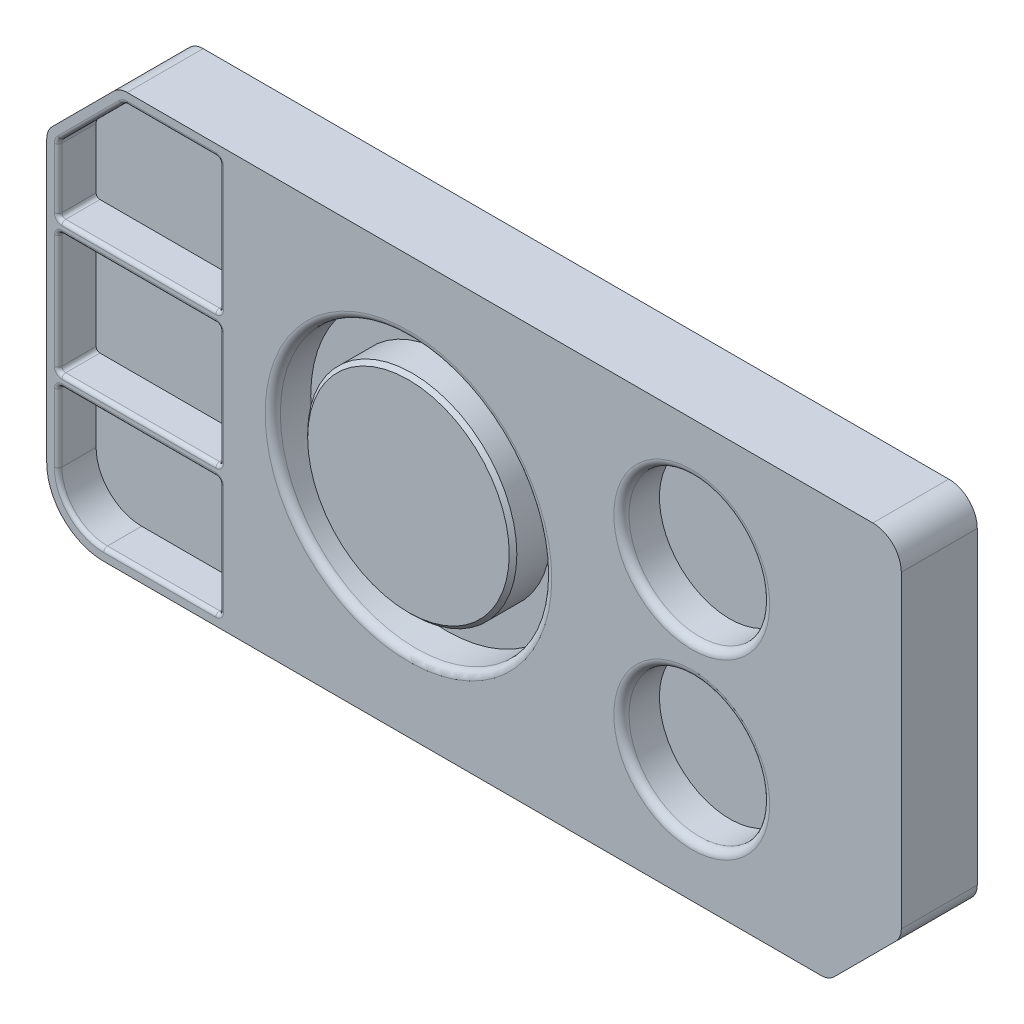
from build123d import *

# Parameters (mm, degrees)
SKETCH1_W           = 225
SKETCH1_H           = 110
BOSS_EXTRUDE2_DEPTH = 10
CHAMFER1_SIZE       = 19.1
FILLET1_R           = 15
FILLET2_R           = 7.5
FILLET3_R           = 5
BOSS_EXTRUDE4_START = 10
SKETCH4_R           = 18.521811602
SKETCH4_W           = 42.513723821
SKETCH4_H           = 32
SKETCH4_R_2         = 35.732188173
BOSS_EXTRUDE4_DEPTH = 10
FILLET4_R           = 2
SKETCH4_5_R         = 27.537925192
BOSS_EXTRUDE5_DEPTH = 10
CHAMFER2_SIZE       = 1
FILLET5_R           = 1
FILLET6_R           = 1
FILLET7_R           = 1


with BuildPart() as part:
    # Sketch1 → Boss-Extrude2 (new body)
    with BuildSketch(Plane.XY):
        Rectangle(SKETCH1_W, SKETCH1_H)
    extrude(amount=BOSS_EXTRUDE2_DEPTH)

    # Chamfer1
    chamfer1_edges = [part.edges().sort_by_distance(p)[0] for p in [
        (112.5, -55, 5),
        (-112.5, 55, 5),
    ]]
    chamfer(chamfer1_edges, length=CHAMFER1_SIZE)

    # Fillet1
    fillet1_edges = [part.edges().sort_by_distance(p)[0] for p in [
        (-112.5, -55, 5),
    ]]
    fillet(fillet1_edges, radius=FILLET1_R)

    # Fillet2
    fillet2_edges = [part.edges().sort_by_distance(p)[0] for p in [
        (112.5, 55, 5),
    ]]
    fillet(fillet2_edges, radius=FILLET2_R)

    # Fillet3
    fillet3_edges = [part.edges().sort_by_distance(p)[0] for p in [
        (112.5, -35.9, 5),
        (93.4, -55, 5),
        (-112.5, 35.9, 5),
        (-93.4, 55, 5),
    ]]
    fillet(fillet3_edges, radius=FILLET3_R)

    # Sketch4 → Boss-Extrude4 (add)
    with BuildSketch(Plane.XY.offset(10).offset(BOSS_EXTRUDE4_START)):
        with BuildLine():
            ThreePointArc((112.5, 47.5), (110.303300859, 52.803300859), (105, 55))
            Line((105, 55), (-91.328932188, 55))
            ThreePointArc((-91.328932188, 55), (-93.24234935, 54.619397663), (-94.864466094, 53.535533906))
            Line((-94.864466094, 53.535533906), (-111.035533906, 37.364466094))
            ThreePointArc((-111.035533906, 37.364466094), (-112.119397663, 35.74234935), (-112.5, 33.828932188))
            Line((-112.5, 33.828932188), (-112.5, -40))
            ThreePointArc((-112.5, -40), (-108.106601718, -50.606601718), (-97.5, -55))
            Line((-97.5, -55), (91.328932188, -55))
            ThreePointArc((91.328932188, -55), (93.24234935, -54.619397663), (94.864466094, -53.535533906))
            Line((94.864466094, -53.535533906), (111.035533906, -37.364466094))
            ThreePointArc((111.035533906, -37.364466094), (112.119397663, -35.74234935), (112.5, -33.828932188))
            Line((112.5, -33.828932188), (112.5, 47.5))
        make_face()
        with BuildLine():
            Line((-66.986276179, -52), (-97.5, -52))
            ThreePointArc((-97.5, -52), (-105.985281374, -48.485281374), (-109.5, -40))
            Line((-109.5, -40), (-109.5, -21))
            Line((-109.5, -21), (-66.986276179, -21))
            Line((-66.986276179, -21), (-66.986276179, -52))
        make_face(mode=Mode.SUBTRACT)
        with Locations(Location((57.333382402, -22.805236931, 0), (0, 0, 180))):
            Circle(SKETCH4_R, mode=Mode.SUBTRACT)
        with BuildLine():
            Line((-66.986276179, 52), (-66.986276179, 17))
            Line((-66.986276179, 17), (-109.5, 17))
            Line((-109.5, 17), (-109.5, 33.828932188))
            ThreePointArc((-109.5, 33.828932188), (-109.347759065, 34.594299053), (-108.914213562, 35.243145751))
            Line((-108.914213562, 35.243145751), (-92.743145751, 51.414213562))
            ThreePointArc((-92.743145751, 51.414213562), (-92.094299053, 51.847759065), (-91.328932188, 52))
            Line((-91.328932188, 52), (-66.986276179, 52))
        make_face(mode=Mode.SUBTRACT)
        with Locations((-88.24313809, -2)):
            Rectangle(SKETCH4_W, SKETCH4_H, mode=Mode.SUBTRACT)
        with Locations((-17.262987298, 0)):
            Circle(SKETCH4_R_2, mode=Mode.SUBTRACT)
        with Locations((57.333382402, 22.805236931)):
            Circle(SKETCH4_R, mode=Mode.SUBTRACT)
    extrude(amount=-BOSS_EXTRUDE4_DEPTH)

    # Fillet4
    fillet4_edges = [part.edges().sort_by_distance(p)[0] for p in [
        (38.8115708, 22.805236931, 20),
        (-52.995175471, 0, 20),
        (75.855194004, -22.805236931, 20),
    ]]
    fillet(fillet4_edges, radius=FILLET4_R)

    # Sketch4<5> → Boss-Extrude5 (add)
    with BuildSketch(Plane.XY.offset(10)):
        with Locations(Location((-17.262987298, 0, 0), (0, 0, 180))):
            Circle(SKETCH4_5_R)
    extrude(amount=BOSS_EXTRUDE5_DEPTH)

    # Chamfer2
    chamfer2_edges = [part.edges().sort_by_distance(p)[0] for p in [
        (10.274937894, 0, 20),
    ]]
    chamfer(chamfer2_edges, length=CHAMFER2_SIZE)

    # Fillet5
    fillet5_edges = [part.edges().sort_by_distance(p)[0] for p in [
        (-109.5, -21, 15),
        (-66.986276179, -21, 15),
        (-66.986276179, -52, 15),
    ]]
    fillet(fillet5_edges, radius=FILLET5_R)

    # Fillet6
    fillet6_edges = [part.edges().sort_by_distance(p)[0] for p in [
        (-66.986276179, 52, 15),
        (-66.986276179, 17, 15),
        (-109.5, 17, 15),
        (-109.5, 14, 15),
        (-66.986276179, 14, 15),
        (-66.986276179, -18, 15),
        (-109.5, -18, 15),
    ]]
    fillet(fillet6_edges, radius=FILLET6_R)

    # Fillet7
    fillet7_edges = [part.edges().sort_by_distance(p)[0] for p in [
        (-109.5, 25.914466094, 20),
        (-109.347759065, 34.594299053, 20),
        (-100.828679656, 43.328679656, 20),
        (-82.743138089, -52, 20),
        (-105.985281374, -48.485281374, 20),
        (-92.094299053, 51.847759065, 20),
        (-66.986276179, -36.5, 20),
        (-88.243138089, -21, 20),
        (-109.5, -31, 20),
        (-67.279169397, -51.707106781, 20),
        (-67.279169397, -21.292893219, 20),
        (-109.207106781, -21.292893219, 20),
        (-109.5, -2, 20),
        (-88.243138089, -18, 20),
        (-88.243138089, 14, 20),
        (-66.986276179, -2, 20),
        (-88.243138089, 17, 20),
        (-66.986276179, 34.5, 20),
        (-79.657604183, 52, 20),
        (-109.207106781, -17.707106781, 20),
        (-109.207106781, 13.707106781, 20),
        (-67.279169397, -17.707106781, 20),
        (-67.279169397, 13.707106781, 20),
        (-109.207106781, 17.292893219, 20),
        (-67.279169397, 17.292893219, 20),
        (-67.279169397, 51.707106781, 20),
    ]]
    fillet(fillet7_edges, radius=FILLET7_R)


solid = part.part
